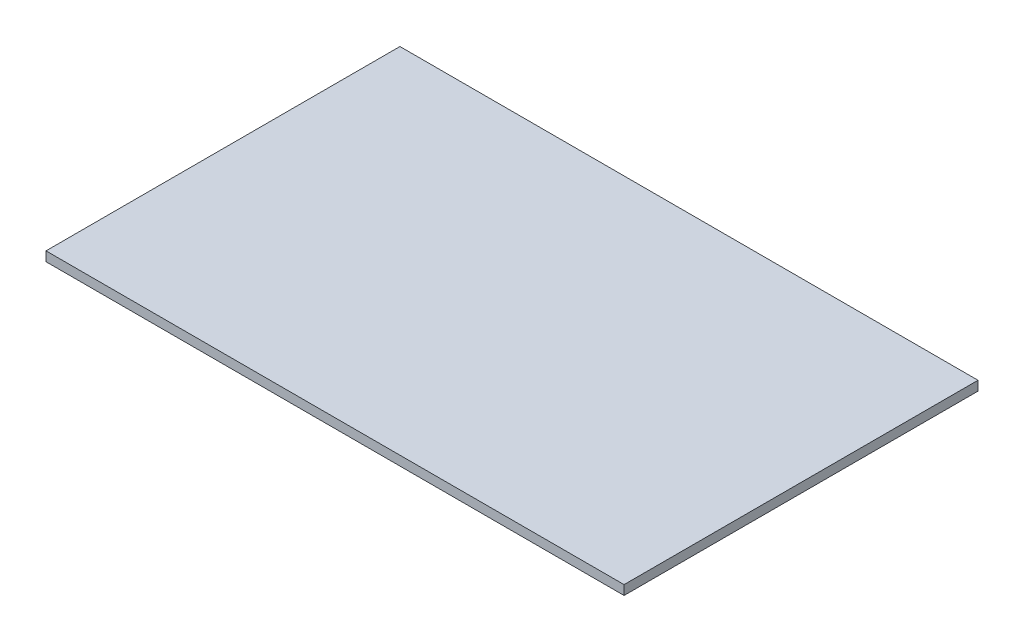
from build123d import *

# Parameters (mm, degrees)
SKETCH2_W           = 245
SKETCH2_H           = 150
BOSS_EXTRUDE1_DEPTH = 4


with BuildPart() as part:
    # Sketch2 → Boss-Extrude1 (new body)
    with BuildSketch(Plane(origin=(0, 0, 0), x_dir=(1, 0, 0), z_dir=(0, 1, 0))):
        Rectangle(SKETCH2_W, SKETCH2_H)
    extrude(amount=BOSS_EXTRUDE1_DEPTH)


solid = part.part
